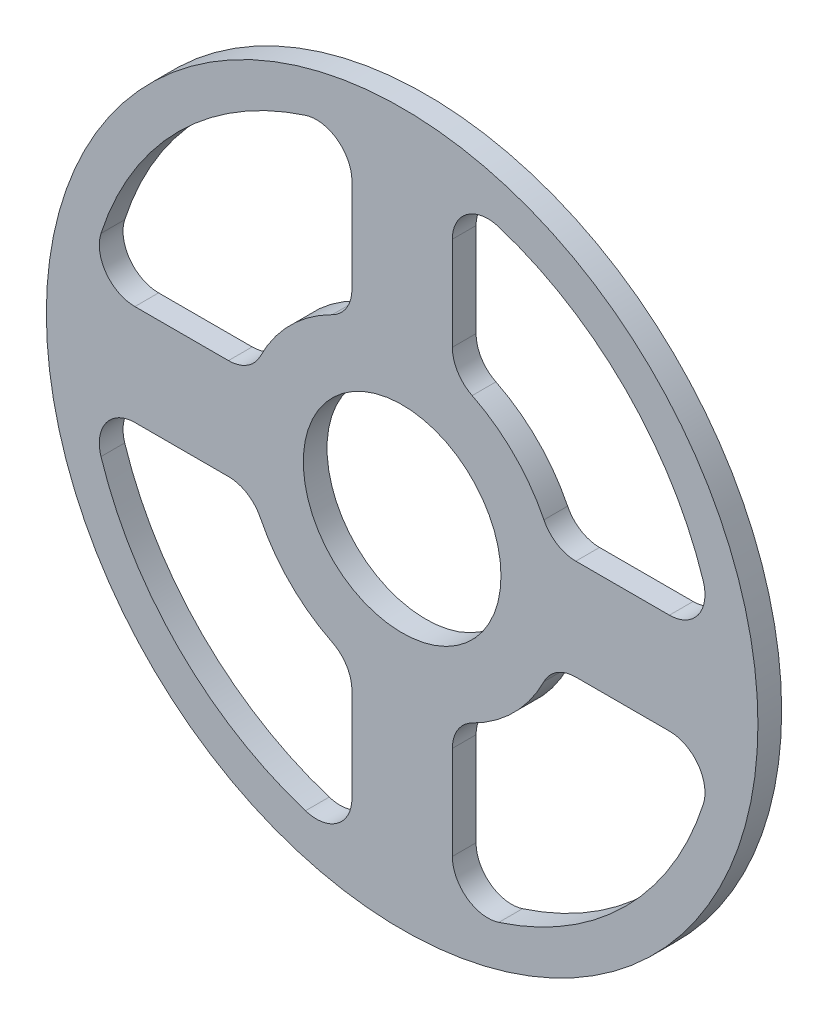
from build123d import *

# Parameters (mm, degrees)
SKETCH_1_R                       = 45
SKETCH_1_R_2                     = 12.5
EXTRUDE_1_DEPTH                  = 1.5
CUT_EXTRUDE_1_DEPTH              = 64.710281745
FILLET_1_R                       = 4.5
PATTERN_CIRCULAR_1_COUNT         = 4
FILLET_1_OF_PATTERN_CIRCULAR_1_R = 4.5


with BuildPart() as part:
    # 스케치1 → 보스-돌출1 (new, symmetric)
    with BuildSketch(Plane.XY):
        Circle(SKETCH_1_R)
        Circle(SKETCH_1_R_2, mode=Mode.SUBTRACT)
    extrude(amount=EXTRUDE_1_DEPTH, both=True)

    # 스케치2 → 컷-돌출1 (cut, through all)
    with BuildSketch(Plane.XY.offset(1.5)):
        with BuildLine():
            Line((6.35, 39.4927525), (6.35, 18.965165436))
            ThreePointArc((6.35, 18.965165436), (14.142135624, 14.142135624), (18.965165436, 6.35))
            Line((18.965165436, 6.35), (39.4927525, 6.35))
            ThreePointArc((39.4927525, 6.35), (28.284271247, 28.284271247), (6.35, 39.4927525))
        make_face()
    cut_extrude_1 = extrude(amount=-CUT_EXTRUDE_1_DEPTH, mode=Mode.SUBTRACT)

    # 필렛1
    fillet_1_edges = [part.edges().sort_by_distance(p)[0] for p in [
        (6.35, 39.4927525, 0),
        (39.4927525, 6.35, 0),
        (18.965165436, 6.35, 0),
        (6.35, 18.965165436, 0),
    ]]
    fillet(fillet_1_edges, radius=FILLET_1_R)

    # 원형 패턴1: 컷-돌출1 ×4 about axis
    pattern_circular_1_axis = Axis((0, 0, 0), (0, 0, 1))
    for i in range(1, PATTERN_CIRCULAR_1_COUNT):
        add(cut_extrude_1.rotate(pattern_circular_1_axis, i * 360 / PATTERN_CIRCULAR_1_COUNT), mode=Mode.SUBTRACT)

    # 필렛1 of 원형 패턴1
    fillet_1_of_pattern_circular_1_edges = [part.edges().sort_by_distance(p)[0] for p in [
        (-39.4927525, 6.35, 0),
        (-6.35, 39.4927525, 0),
        (-6.35, 18.965165436, 0),
        (-18.965165436, 6.35, 0),
        (-6.35, -39.4927525, 0),
        (-39.4927525, -6.35, 0),
        (-18.965165436, -6.35, 0),
        (-6.35, -18.965165436, 0),
        (39.4927525, -6.35, 0),
        (6.35, -39.4927525, 0),
        (6.35, -18.965165436, 0),
        (18.965165436, -6.35, 0),
    ]]
    fillet(fillet_1_of_pattern_circular_1_edges, radius=FILLET_1_OF_PATTERN_CIRCULAR_1_R)


solid = part.part
